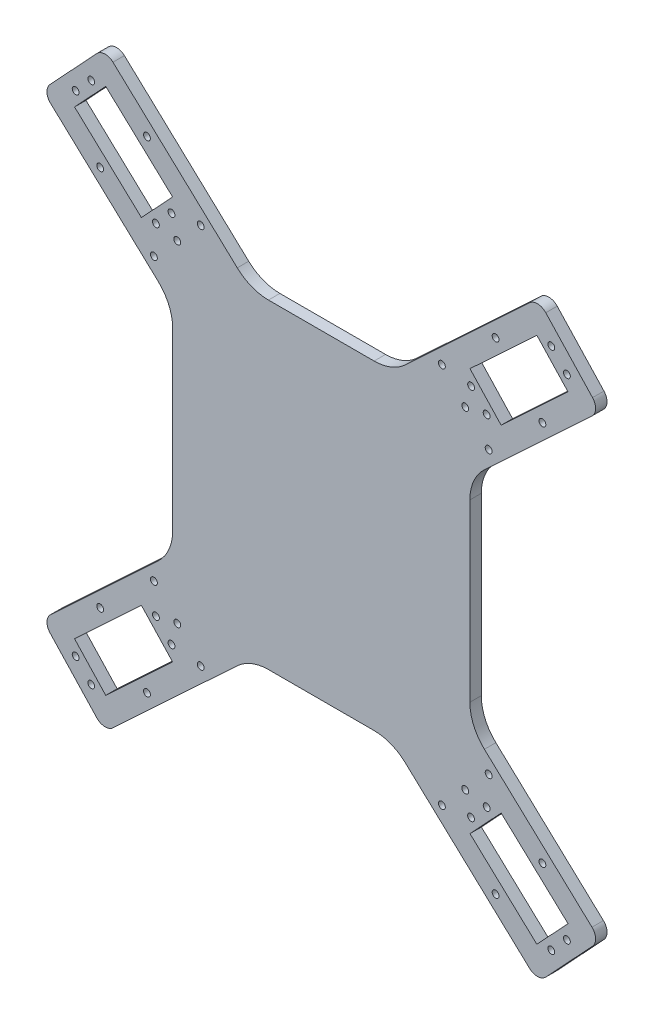
from build123d import *

# Parameters (mm, degrees)
EXTRUDE_1_DEPTH     = 5
SKETCH_2_3_R        = 1.5
CUT_EXTRUDE_1_DEPTH = 5
SKETCH_3_R          = 1.5
CUT_EXTRUDE_2_DEPTH = 10
SKETCH_4_R          = 1.5
CUT_EXTRUDE_3_DEPTH = 33


with BuildPart() as part:
    # 草图2 → 凸台-拉伸1 (new body)
    with BuildSketch(Plane.XY):
        with BuildLine():
            Line((2769.066394733, 1854.135920645), (2815.285788336, 1854.135920645))
            ThreePointArc((2815.285788336, 1854.135920645), (2822.615812871, 1855.527569285), (2828.925755538, 1859.508846613))
            Line((2828.925755538, 1859.508846613), (2883.306876366, 1910.220062186))
            ThreePointArc((2883.306876366, 1910.220062186), (2886.89136565, 1911.560247813), (2890.373636674, 1909.973285478))
            Line((2890.373636674, 1909.973285478), (2910.833587476, 1888.03267443))
            ThreePointArc((2910.833587476, 1888.03267443), (2912.173773103, 1884.448185146), (2910.586810768, 1880.965914121))
            Line((2910.586810768, 1880.965914121), (2863.536124333, 1837.090439207))
            ThreePointArc((2863.536124333, 1837.090439207), (2858.834890047, 1830.438346554), (2857.176091534, 1822.463365175))
            Line((2857.176091534, 1822.463365175), (2857.176091534, 1745.808476115))
            ThreePointArc((2857.176091534, 1745.808476115), (2858.834890047, 1737.833494737), (2863.536124333, 1731.181402083))
            Line((2863.536124333, 1731.181402083), (2910.586810768, 1687.305927169))
            ThreePointArc((2910.586810768, 1687.305927169), (2912.173773103, 1683.823656144), (2910.833587476, 1680.239166861))
            Line((2910.833587476, 1680.239166861), (2890.373636674, 1658.298555812))
            ThreePointArc((2890.373636674, 1658.298555812), (2886.89136565, 1656.711593477), (2883.306876366, 1658.051779104))
            Line((2883.306876366, 1658.051779104), (2828.925755538, 1708.762994677))
            ThreePointArc((2828.925755538, 1708.762994677), (2822.615812871, 1712.744272005), (2815.285788336, 1714.135920645))
            Line((2815.285788336, 1714.135920645), (2769.066394733, 1714.135920645))
            ThreePointArc((2769.066394733, 1714.135920645), (2761.736370198, 1712.744272005), (2755.426427531, 1708.762994677))
            Line((2755.426427531, 1708.762994677), (2701.045306703, 1658.051779104))
            ThreePointArc((2701.045306703, 1658.051779104), (2697.460817419, 1656.711593477), (2693.978546395, 1658.298555812))
            Line((2693.978546395, 1658.298555812), (2673.518595593, 1680.239166861))
            ThreePointArc((2673.518595593, 1680.239166861), (2672.178409966, 1683.823656144), (2673.765372301, 1687.305927169))
            Line((2673.765372301, 1687.305927169), (2720.816058736, 1731.181402083))
            ThreePointArc((2720.816058736, 1731.181402083), (2725.517293022, 1737.833494737), (2727.176091534, 1745.808476115))
            Line((2727.176091534, 1745.808476115), (2727.176091534, 1822.463365175))
            ThreePointArc((2727.176091534, 1822.463365175), (2725.517293022, 1830.438346554), (2720.816058736, 1837.090439207))
            Line((2720.816058736, 1837.090439207), (2673.765372301, 1880.965914121))
            ThreePointArc((2673.765372301, 1880.965914121), (2672.178409966, 1884.448185146), (2673.518595593, 1888.03267443))
            Line((2673.518595593, 1888.03267443), (2693.978546395, 1909.973285478))
            ThreePointArc((2693.978546395, 1909.973285478), (2697.460817419, 1911.560247813), (2701.045306703, 1910.220062186))
            Line((2701.045306703, 1910.220062186), (2755.426427531, 1859.508846613))
            ThreePointArc((2755.426427531, 1859.508846613), (2761.736370198, 1855.527569285), (2769.066394733, 1854.135920645))
        make_face()
    extrude(amount=EXTRUDE_1_DEPTH)

    # 草图2<3> → 切除-拉伸1 (cut)
    with BuildSketch(Plane.XY):
        Polygon((2900.110058659, 1884.869459337), (2886.470091458, 1899.496533369), (2857.215943393, 1872.216598967), (2870.855910595, 1857.589524935), align=None)
        Polygon((2727.136239676, 1872.216598967), (2697.882091611, 1899.496533369), (2684.242124409, 1884.869459337), (2713.496272474, 1857.589524935), align=None)
        Polygon((2857.215943393, 1696.055242323), (2886.470091458, 1668.775307921), (2900.110058659, 1683.402381953), (2870.855910595, 1710.682316356), align=None)
        Polygon((2684.242124409, 1683.402381953), (2697.882091611, 1668.775307921), (2727.136239676, 1696.055242323), (2713.496272474, 1710.682316356), align=None)
        with Locations((2892.805498065, 1898.567758302)):
            Circle(SKETCH_2_3_R)
        with Locations((2899.625481666, 1891.254221285)):
            Circle(SKETCH_2_3_R)
        with Locations((2857.700520387, 1865.831837019)):
            Circle(SKETCH_2_3_R)
        with Locations((2864.520503988, 1858.518300002)):
            Circle(SKETCH_2_3_R)
        with Locations((2691.546685004, 1898.567758302)):
            Circle(SKETCH_2_3_R)
        with Locations((2684.726701403, 1891.254221285)):
            Circle(SKETCH_2_3_R)
        with Locations((2726.651662682, 1865.831837019)):
            Circle(SKETCH_2_3_R)
        with Locations((2719.831679081, 1858.518300002)):
            Circle(SKETCH_2_3_R)
        with Locations((2892.805498065, 1669.704082989)):
            Circle(SKETCH_2_3_R)
        with Locations((2899.625481666, 1677.017620005)):
            Circle(SKETCH_2_3_R)
        with Locations((2857.700520387, 1702.440004272)):
            Circle(SKETCH_2_3_R)
        with Locations((2864.520503988, 1709.753541288)):
            Circle(SKETCH_2_3_R)
        with Locations((2691.546685004, 1669.704082989)):
            Circle(SKETCH_2_3_R)
        with Locations((2684.726701403, 1677.017620005)):
            Circle(SKETCH_2_3_R)
        with Locations((2726.651662682, 1702.440004272)):
            Circle(SKETCH_2_3_R)
        with Locations((2719.831679081, 1709.753541288)):
            Circle(SKETCH_2_3_R)
    extrude(amount=CUT_EXTRUDE_1_DEPTH, mode=Mode.SUBTRACT)

    # 草图3 → 切除-拉伸2 (cut)
    with BuildSketch(Plane(origin=(0, 0, 0), x_dir=(-1, 0, 0), z_dir=(0, 0, -1))):
        with Locations((-2888.892976427, 1700.699117662)):
            Circle(SKETCH_3_R)
        with Locations((-2868.433025626, 1678.758506614)):
            Circle(SKETCH_3_R)
        with Locations((-2715.919157443, 1678.758506614)):
            Circle(SKETCH_3_R)
        with Locations((-2695.459206642, 1700.699117662)):
            Circle(SKETCH_3_R)
        with Locations((-2695.459206642, 1867.572723628)):
            Circle(SKETCH_3_R)
        with Locations((-2715.919157443, 1889.513334676)):
            Circle(SKETCH_3_R)
        with Locations((-2868.433025626, 1889.513334676)):
            Circle(SKETCH_3_R)
        with Locations((-2888.892976427, 1867.572723628)):
            Circle(SKETCH_3_R)
    extrude(amount=-CUT_EXTRUDE_2_DEPTH, mode=Mode.SUBTRACT)

    # 草图4 → 切除-拉伸3 (cut)
    with BuildSketch(Plane(origin=(0, 0, 0), x_dir=(-1, 0, 0), z_dir=(0, 0, -1))):
        with Locations((-2865.391879185, 1722.614245382)):
            Circle(SKETCH_4_R)
        with Locations((-2855.161903784, 1711.643939858)):
            Circle(SKETCH_4_R)
        with Locations((-2844.931928383, 1700.673634334)):
            Circle(SKETCH_4_R)
        with Locations((-2739.420254686, 1700.673634334)):
            Circle(SKETCH_4_R)
        with Locations((-2729.190279285, 1711.643939858)):
            Circle(SKETCH_4_R)
        with Locations((-2718.960303884, 1722.614245382)):
            Circle(SKETCH_4_R)
        with Locations((-2718.960303884, 1845.657595908)):
            Circle(SKETCH_4_R)
        with Locations((-2729.190279285, 1856.627901432)):
            Circle(SKETCH_4_R)
        with Locations((-2739.420254686, 1867.598206957)):
            Circle(SKETCH_4_R)
        with Locations((-2844.931928383, 1867.598206957)):
            Circle(SKETCH_4_R)
        with Locations((-2855.161903784, 1856.627901432)):
            Circle(SKETCH_4_R)
        with Locations((-2865.391879185, 1845.657595908)):
            Circle(SKETCH_4_R)
    extrude(amount=-CUT_EXTRUDE_3_DEPTH, mode=Mode.SUBTRACT)


solid = part.part
